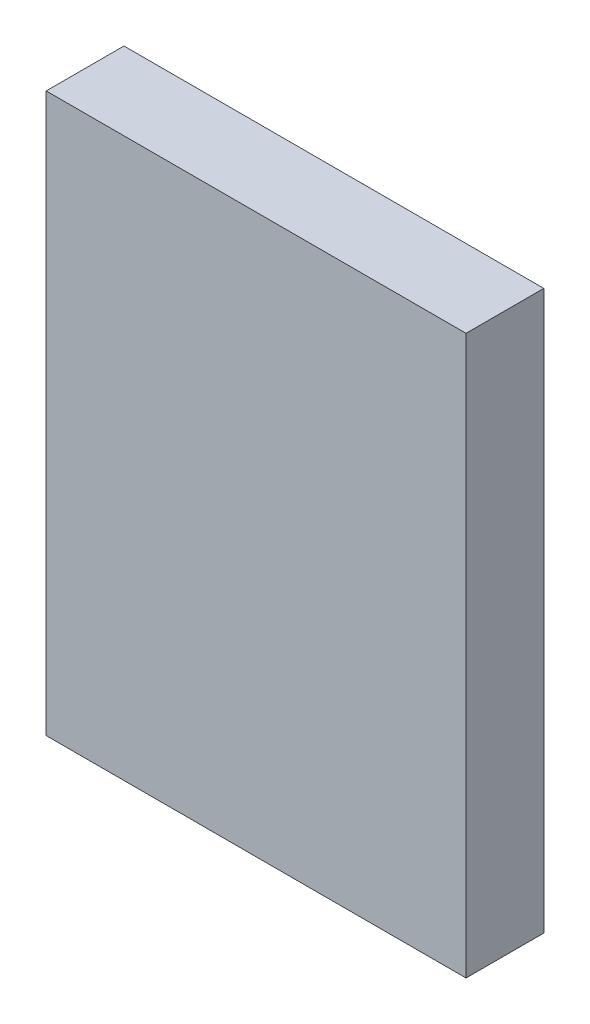
from build123d import *

# Parameters (mm, degrees)
MODEL_W             = 97.14935
MODEL_H             = 129.19946
EXTRUDE_1_DEPTH     = 15
SKETCH_5_W          = 97.14935
SKETCH_5_H          = 129.19946
EXTRUDE_2_DEPTH     = 3
SKETCH_4_W          = 8
SKETCH_4_H          = 25
CUT_EXTRUDE_1_DEPTH = 2


with BuildPart() as part:
    # Model → 凸台-拉伸1 (new body)
    with BuildSketch(Plane.XY):
        with Locations((140.734852429, 91.461726055)):
            Rectangle(MODEL_W, MODEL_H)
        Polygon((102.160177429, 94.384872236), (102.160177429, 82.384872236), (102.160177429, 35.884872236), (102.160177429, 29.861996055), (179.309527429, 29.861996055), (179.309527429, 35.884872236), (179.309527429, 82.384872236), (179.309527429, 94.384872236), (179.309527429, 118.984602236), (179.309527429, 126.061456055), (179.309527429, 151.036037203), (102.185575181, 151.036037203), (102.160177429, 126.061456055), (102.160177429, 118.984602236), align=None, mode=Mode.SUBTRACT)
    extrude(amount=EXTRUDE_1_DEPTH)

    # 草图5 → 凸台-拉伸2 (add)
    with BuildSketch(Plane.XY.offset(15)):
        with Locations((140.734852429, 91.461726055)):
            Rectangle(SKETCH_5_W, SKETCH_5_H)
    extrude(amount=EXTRUDE_2_DEPTH)

    # 草图4 → 切除-拉伸1 (cut)
    with BuildSketch(Plane.XY):
        with Locations((98.160177429, 29.884872236)):
            Rectangle(SKETCH_4_W, SKETCH_4_H)
        with Locations((183.309527429, 88.384872236)):
            Rectangle(SKETCH_4_W, SKETCH_4_H)
        with Locations((98.160177429, 88.384872236)):
            Rectangle(SKETCH_4_W, SKETCH_4_H)
        with Locations((183.309527429, 29.884872236)):
            Rectangle(SKETCH_4_W, SKETCH_4_H)
    extrude(amount=CUT_EXTRUDE_1_DEPTH, mode=Mode.SUBTRACT)


solid = part.part
